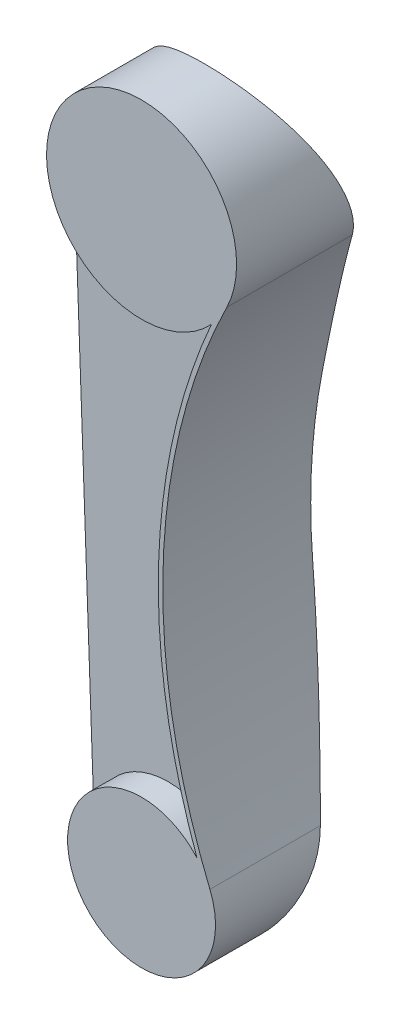
from build123d import *
from build123d.topology import SkipClean

# Parameters (mm, degrees)
SKETCH_1_R               = 106
EXTRUDE_1_DEPTH          = 70
SKETCH_2_R               = 82.5
EXTRUDE_2_DEPTH          = 59.51
EXTRUDE_2_2_DEPTH        = 165
EXTRUDE_3_DEPTH          = 135.245
CUT_EXTRUDE_1_DEPTH      = 759.298918633
CUT_EXTRUDE_1_DEPTH_BACK = 759.298918633


with BuildPart() as part:
    # 草圖1 → 填料-伸長1 (new body)
    with BuildSketch(Plane.XY):
        Circle(SKETCH_1_R)
    extrude(amount=-EXTRUDE_1_DEPTH)



with BuildPart() as body_2:
    # 草圖2 → Extrude 2 (new body)
    with BuildSketch(Plane.XY):
        with Locations((0, -650)):
            Circle(SKETCH_2_R)
    extrude(amount=-EXTRUDE_2_DEPTH)


with BuildPart() as part_1:
    with SkipClean():  # the faces are left unmerged after this step: merging them gives an invalid solid
        add(part.part)

        add(body_2.part)  # Extrude 2 2 merges body 2
        # 草圖5 → Extrude 2 2 (add)
        with BuildSketch(Plane.XY):
            with BuildLine():
                ThreePointArc((-105.723256406, -7.654610039), (20.294582586, 104.039078801), (95.095556669, -46.827717239))
                ThreePointArc((95.095556669, -46.827717239), (24.058429711, -330.636348878), (76.252402834, -618.506809274))
                ThreePointArc((76.252402834, -618.506809274), (16.053453931, -730.923028965), (-82.5, -650))
                Line((-82.5, -650), (-77.5, -650))
                ThreePointArc((-77.5, -650), (15.080517329, -726.018602967), (71.631045086, -620.4154875))
                ThreePointArc((71.631045086, -620.4154875), (19.06114358, -330.471632986), (90.609917204, -44.618862652))
                ThreePointArc((90.609917204, -44.618862652), (19.337290954, 99.131575084), (-100.736310349, -7.293543528))
                Line((-100.736310349, -7.293543528), (-105.723256406, -7.654610039))
            make_face()
        extrude(amount=-EXTRUDE_2_2_DEPTH)

    # 草圖6 → 填料-伸長3 (add)
    with BuildSketch(Plane.XY.offset(-29.755)):
        with BuildLine():
            Line((-82.5, -650), (-105.723256406, -7.654610039))
            ThreePointArc((-105.723256406, -7.654610039), (20.294582586, 104.039078801), (95.095556669, -46.827717239))
            ThreePointArc((95.095556669, -46.827717239), (24.058429711, -330.636348878), (76.252402834, -618.506809274))
            ThreePointArc((76.252402834, -618.506809274), (16.053453931, -730.923028965), (-82.5, -650))
        make_face()
    extrude(amount=-EXTRUDE_3_DEPTH)

    # 草圖7 → 除料-伸長1 (cut, two sides: drawn at the far end of the back side and taken through both)
    with BuildSketch(Plane(origin=(0, 0, 0), x_dir=(0, 0, -1), z_dir=(1, 0, 0)).offset(-CUT_EXTRUDE_1_DEPTH_BACK)):
        with BuildLine():
            Line((165, -732.5), (59.51, -732.5))
            ThreePointArc((59.51, -732.5), (137.967226394, -578.345793115), (165, -407.5))
            Line((165, -407.5), (165, -732.5))
        make_face()
        with BuildLine():
            Line((70, 106), (165, 106))
            Line((165, 106), (165, -219))
            ThreePointArc((165, -219), (140.76325893, -49.699970467), (70, 106))
        make_face()
    extrude(amount=CUT_EXTRUDE_1_DEPTH + CUT_EXTRUDE_1_DEPTH_BACK, mode=Mode.SUBTRACT)


solid = part_1.part
